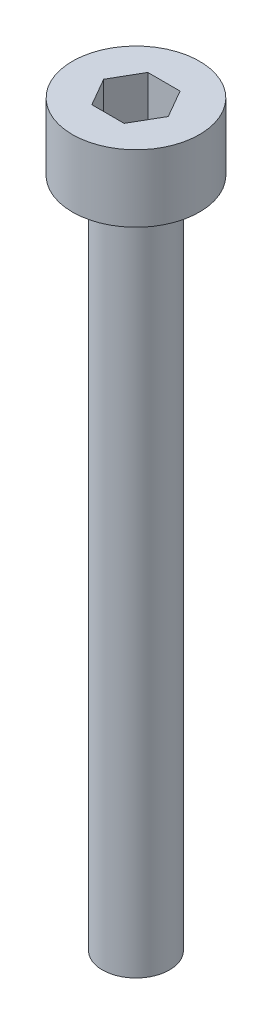
from build123d import *

# Parameters (mm, degrees)
SKETCH1_R           = 2.84
BOSS_EXTRUDE1_DEPTH = 3
SKETCH2_R           = 1.5
BOSS_EXTRUDE2_DEPTH = 30


with BuildPart() as part:
    # Sketch1 → Boss-Extrude1 (new body)
    with BuildSketch(Plane(origin=(0, 0, 0), x_dir=(1, 0, 0), z_dir=(0, 1, 0))):
        with Locations(Location((0, 0, 0), (0, 0, 270))):
            Circle(SKETCH1_R)
        Polygon((0.721687836, 1.25), (-0.721687836, 1.25), (-1.443375673, 0), (-0.721687836, -1.25), (0.721687836, -1.25), (1.443375673, 0), align=None, mode=Mode.SUBTRACT)
    extrude(amount=BOSS_EXTRUDE1_DEPTH)

    # Sketch2 → Boss-Extrude2 (add)
    with BuildSketch(Plane.XZ):
        with Locations(Location((0, 0, 0), (0, 0, 90))):
            Circle(SKETCH2_R)
    extrude(amount=BOSS_EXTRUDE2_DEPTH)


solid = part.part
